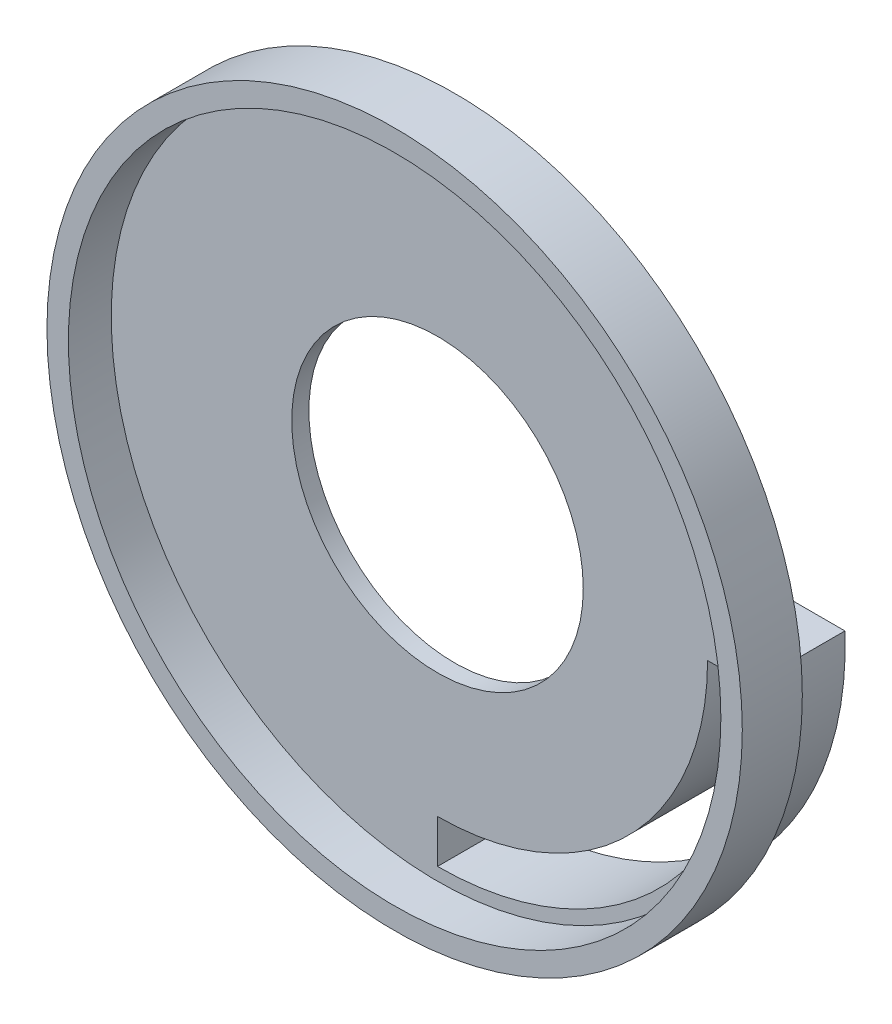
from build123d import *

# Parameters (mm, degrees)
SKETCH_1_R           = 76.1
SKETCH_1_R_2         = 34
EXTRUDE_1_DEPTH      = 4
EXTRUDE_2_DEPTH      = 10
EXTRUDE_2_DEPTH_BACK = 4
SKETCH_2_R           = 81.1
SKETCH_2_R_2         = 76.1
CUT_EXTRUDE_1_DEPTH  = 5
EXTRUDE_3_DEPTH      = 15


with BuildPart() as part:
    # 스케치1 → 보스-돌출1 (new body)
    with BuildSketch(Plane.XY):
        Circle(SKETCH_1_R)
        Circle(SKETCH_1_R_2, mode=Mode.SUBTRACT)
    extrude(amount=EXTRUDE_1_DEPTH)

    # 스케치2 → 보스-돌출2 (add, two sides: drawn at the far end of the back side and taken through both)
    with BuildSketch(Plane.XY.offset(4).offset(-EXTRUDE_2_DEPTH_BACK)):
        Circle(SKETCH_2_R)
        Circle(SKETCH_2_R_2, mode=Mode.SUBTRACT)
    extrude(amount=EXTRUDE_2_DEPTH + EXTRUDE_2_DEPTH_BACK)

    # 스케치3 → 컷-돌출1 (cut)
    with BuildSketch(Plane.XY.offset(4)):
        with BuildLine():
            Line((63, 0), (73.1, 0))
            ThreePointArc((73.1, 0), (51.689505705, -51.689505705), (0, -73.1))
            Line((0, -73.1), (0, -63))
            ThreePointArc((0, -63), (44.547727215, -44.547727215), (63, 0))
        make_face()
    extrude(amount=-CUT_EXTRUDE_1_DEPTH, mode=Mode.SUBTRACT)

    # 스케치4 → 보스-돌출3 (add)
    with BuildSketch(Plane(origin=(0, 0, 0), x_dir=(-1, 0, 0), z_dir=(0, 0, -1))):
        with BuildLine():
            Line((-59.924953066, 3), (-76.040844288, 3))
            ThreePointArc((-76.040844288, 3), (-53.810826048, -53.810826048), (3, -76.040844288))
            Line((3, -76.040844288), (3, -59.924953066))
            ThreePointArc((3, -59.924953066), (-42.426406871, -42.426406871), (-59.924953066, 3))
        make_face()
        with BuildLine():
            Line((-63, 0), (-73.1, 0))
            ThreePointArc((-73.1, 0), (-51.689505705, -51.689505705), (0, -73.1))
            Line((0, -73.1), (0, -63))
            ThreePointArc((0, -63), (-44.547727215, -44.547727215), (-63, 0))
        make_face(mode=Mode.SUBTRACT)
    extrude(amount=EXTRUDE_3_DEPTH)


solid = part.part
